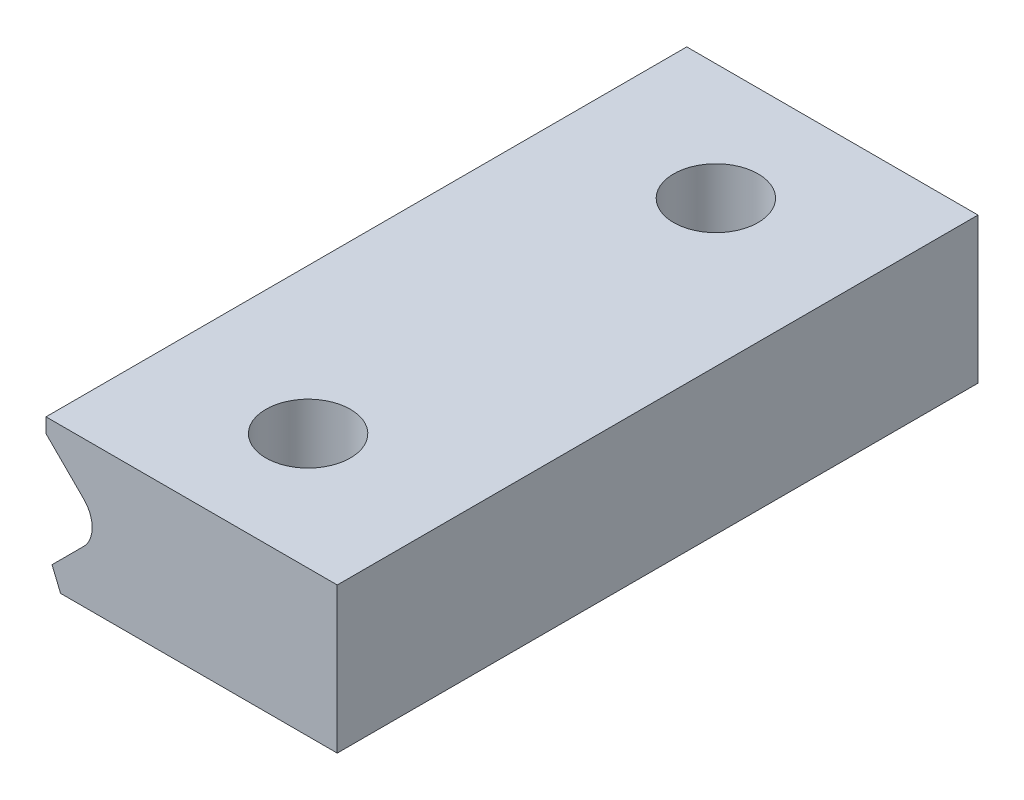
from build123d import *

# Parameters (mm, degrees)
BOSS_EXTRUDE1_DEPTH                                 = 11
FILLET1_R                                           = 1
CHAMFER1_SIZE                                       = 1
CUT_EXTRUDE1_DEPTH                                  = 25.50510151
CSK_FOR_M2_5_CROSS_RECESSED_RAISED_CTSK_D           = 2.9
CSK_FOR_M2_5_CROSS_RECESSED_RAISED_CTSK_CSINK_D     = 5.4
CSK_FOR_M2_5_CROSS_RECESSED_RAISED_CTSK_CSINK_ANGLE = 90


with BuildPart() as part:
    # Sketch1 → Boss-Extrude1 (new, symmetric)
    with BuildSketch(Plane.XY):
        Polygon((-10.5, 2.5), (-8, 0), (-10.5, -2.5), (0, -2.5), (0, 2.5), align=None)
    extrude(amount=BOSS_EXTRUDE1_DEPTH, both=True)

    # Fillet1
    fillet1_edges = [part.edges().sort_by_distance(p)[0] for p in [
        (-8, 0, 0),
    ]]
    fillet(fillet1_edges, radius=FILLET1_R)

    # Chamfer1
    chamfer1_edges = [part.edges().sort_by_distance(p)[0] for p in [
        (-10.5, -2.5, 0),
    ]]
    chamfer(chamfer1_edges, length=CHAMFER1_SIZE)

    # Sketch2 → Cut-Extrude1 (cut, through all)
    with BuildSketch(Plane.XY.offset(11)):
        Polygon((-10.5, 2.5), (-10, 2), (-10, 2.5), align=None)
    extrude(amount=-CUT_EXTRUDE1_DEPTH, mode=Mode.SUBTRACT)

    # CSK for M2.5 Cross recessed raised CTSK head wood screws1 (through all)
    with Locations(Plane(origin=(-5, -2.5, 7), x_dir=(-1, 0, 0), z_dir=(0, -1, 0))):
        with Locations((0, 0), (0, 14)):
            CounterSinkHole(CSK_FOR_M2_5_CROSS_RECESSED_RAISED_CTSK_D / 2, CSK_FOR_M2_5_CROSS_RECESSED_RAISED_CTSK_CSINK_D / 2, counter_sink_angle=CSK_FOR_M2_5_CROSS_RECESSED_RAISED_CTSK_CSINK_ANGLE)


solid = part.part
